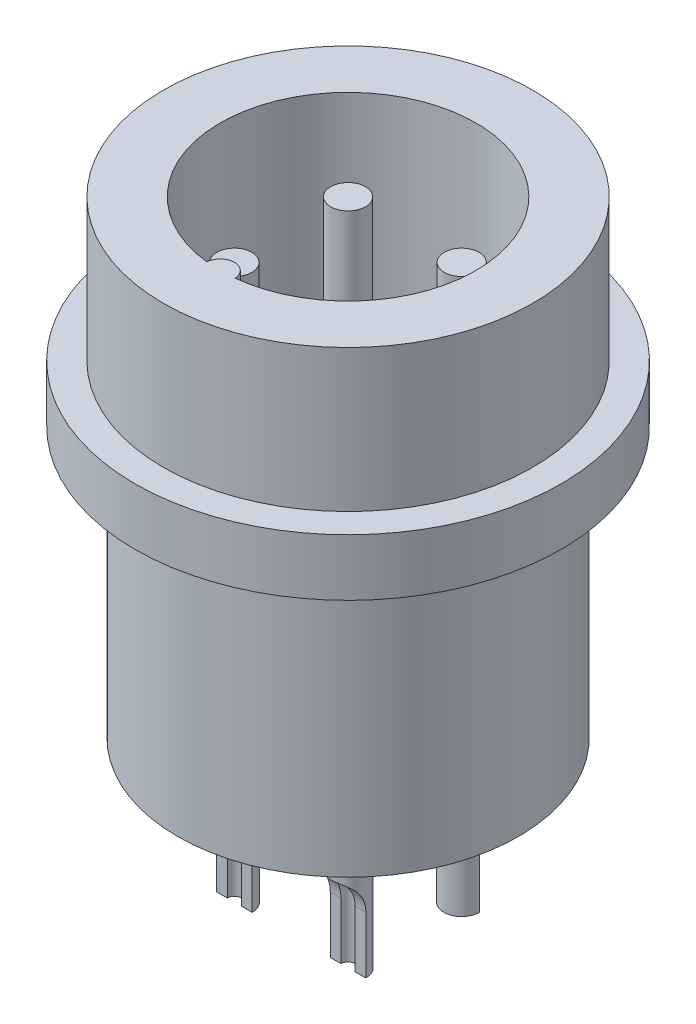
from build123d import *

# Parameters (mm, degrees)
SKETCH_1_R          = 6
EXTRUDE_1_DEPTH     = 9.5
SKETCH_2_R          = 7.5
EXTRUDE_2_DEPTH     = 2
SKETCH_3_R          = 6.5
EXTRUDE_3_DEPTH     = 5
SKETCH_4_R          = 4.5
CUT_EXTRUDE_1_DEPTH = 10
EXTRUDE_START       = 10
EXTRUDE_4_DEPTH     = 10
SKETCH_6_R          = 0.6125
EXTRUDE_5_DEPTH     = 8
SKETCH_7_R          = 0.625
EXTRUDE_6_DEPTH     = 5
SKETCH_8_R          = 0.25
CUT_EXTRUDE_2_DEPTH = 3
CUT_EXTRUDE_3_DEPTH = 10


with BuildPart() as part:
    # Эскиз1 → Бобышка-Вытянуть1 (new body)
    with BuildSketch(Plane(origin=(0, 0, 0), x_dir=(1, 0, 0), z_dir=(0, 1, 0))):
        with Locations(Location((0, 0, 0), (0, 0, 270))):
            Circle(SKETCH_1_R)
    extrude(amount=EXTRUDE_1_DEPTH)

    # Эскиз2 → Бобышка-Вытянуть2 (add)
    with BuildSketch(Plane(origin=(0, 9.5, 0), x_dir=(1, 0, 0), z_dir=(0, 1, 0))):
        with Locations(Location((0, 0, 0), (0, 0, 270))):
            Circle(SKETCH_2_R)
    extrude(amount=EXTRUDE_2_DEPTH)

    # Эскиз3 → Бобышка-Вытянуть3 (add)
    with BuildSketch(Plane(origin=(0, 11.5, 0), x_dir=(1, 0, 0), z_dir=(0, 1, 0))):
        with Locations(Location((0, 0, 0), (0, 0, 270))):
            Circle(SKETCH_3_R)
    extrude(amount=EXTRUDE_3_DEPTH)

    # Эскиз4 → Вырез-Вытянуть1 (cut)
    with BuildSketch(Plane(origin=(0, 16.5, 0), x_dir=(1, 0, 0), z_dir=(0, 1, 0))):
        with Locations(Location((0, 0, 0), (0, 0, 270))):
            Circle(SKETCH_4_R)
    extrude(amount=-CUT_EXTRUDE_1_DEPTH, mode=Mode.SUBTRACT)

    # Эскиз5 → Бобышка-Вытянуть4 (add)
    with BuildSketch(Plane(origin=(0, 6.5, 0), x_dir=(1, 0, 0), z_dir=(0, 1, 0)).offset(EXTRUDE_START)):
        with BuildLine():
            ThreePointArc((-0.499227799, -4.472222222), (0, -4.5), (0.499227799, -4.472222222))
            ThreePointArc((0.499227799, -4.472222222), (0, -4), (-0.499227799, -4.472222222))
        make_face()
    extrude(amount=-EXTRUDE_4_DEPTH)

    # Эскиз6 → Бобышка-Вытянуть5 (add)
    with BuildSketch(Plane(origin=(0, 6.5, 0), x_dir=(1, 0, 0), z_dir=(0, 1, 0))):
        with Locations(Location((-2, 2, 0), (0, 0, 270))):
            Circle(SKETCH_6_R)
        with Locations(Location((-2, -2, 0), (0, 0, 270))):
            Circle(SKETCH_6_R)
        with Locations(Location((2, -2, 0), (0, 0, 270))):
            Circle(SKETCH_6_R)
        with Locations(Location((2, 2, 0), (0, 0, 270))):
            Circle(SKETCH_6_R)
    extrude(amount=EXTRUDE_5_DEPTH)

    # Эскиз7 → Бобышка-Вытянуть6 (add)
    with BuildSketch(Plane.XZ):
        with Locations(Location((2, -2, 0), (0, 0, 90))):
            Circle(SKETCH_7_R)
        with Locations(Location((-2, -2, 0), (0, 0, 90))):
            Circle(SKETCH_7_R)
        with Locations(Location((-2, 2, 0), (0, 0, 90))):
            Circle(SKETCH_7_R)
        with Locations(Location((2, 2, 0), (0, 0, 90))):
            Circle(SKETCH_7_R)
    extrude(amount=EXTRUDE_6_DEPTH)

    # Эскиз8 → Вырез-Вытянуть2 (cut)
    with BuildSketch(Plane.XZ.offset(5)):
        with Locations(Location((2, -2, 0), (0, 0, 270))):
            Circle(SKETCH_8_R)
        with Locations(Location((-2, -2, 0), (0, 0, 270))):
            Circle(SKETCH_8_R)
        with Locations(Location((-2, 2, 0), (0, 0, 270))):
            Circle(SKETCH_8_R)
        with Locations(Location((2, 2, 0), (0, 0, 270))):
            Circle(SKETCH_8_R)
    extrude(amount=-CUT_EXTRUDE_2_DEPTH, mode=Mode.SUBTRACT)

    # Эскиз9 → Вырез-Вытянуть3 (cut, symmetric)
    with BuildSketch(Plane(origin=(0, 0, 0), x_dir=(0, 0, -1), z_dir=(1, 0, 0))):
        with BuildLine():
            Line((2, -5), (2.625, -5))
            Line((2.625, -5), (2.625, -2))
            ThreePointArc((2.625, -2), (2.169101887, -2.410376179), (2, -3))
            Line((2, -3), (2, -5))
        make_face()
        with BuildLine():
            Line((-2, -5), (-2.625, -5))
            Line((-2.625, -5), (-2.625, -2))
            ThreePointArc((-2.625, -2), (-2.169101887, -2.410376179), (-2, -3))
            Line((-2, -3), (-2, -5))
        make_face()
    extrude(amount=CUT_EXTRUDE_3_DEPTH, both=True, mode=Mode.SUBTRACT)


solid = part.part
